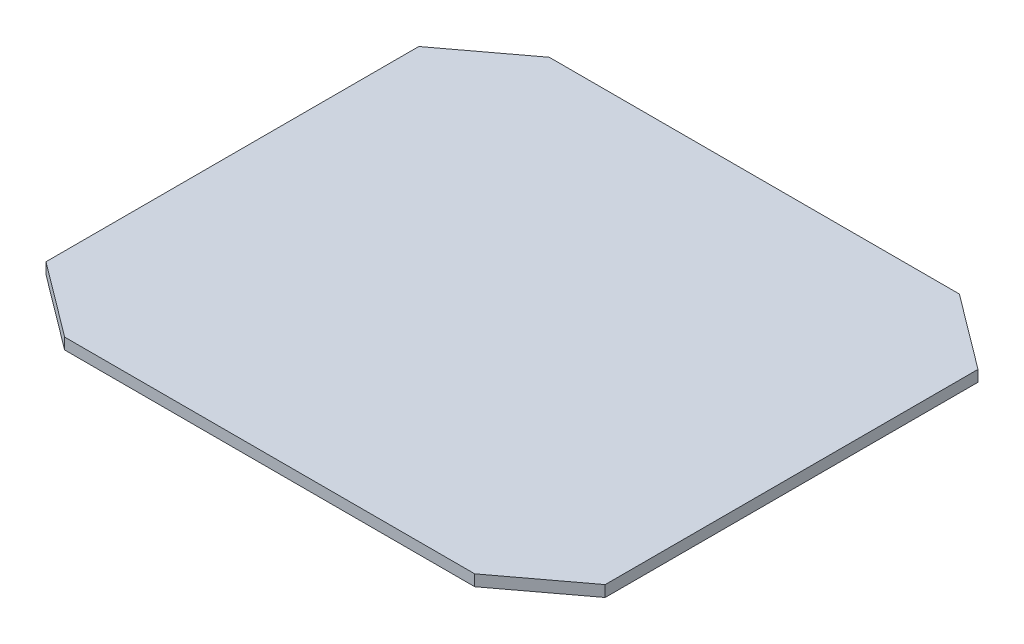
from build123d import *

# Parameters (mm, degrees)
SKETCH1_W           = 150
SKETCH1_H           = 130
BOSS_EXTRUDE1_DEPTH = 3
CUT_EXTRUDE1_DEPTH  = 100.292497199


with BuildPart() as part:
    # Sketch1 → Boss-Extrude1 (new body)
    with BuildSketch(Plane(origin=(0, 0, 0), x_dir=(1, 0, 0), z_dir=(0, 1, 0))):
        Rectangle(SKETCH1_W, SKETCH1_H)
    extrude(amount=BOSS_EXTRUDE1_DEPTH)

    # Sketch2 → Cut-Extrude1 (cut, through all)
    with BuildSketch(Plane(origin=(0, 3, 0), x_dir=(1, 0, 0), z_dir=(0, 1, 0))):
        Polygon((-55, 65), (-75, 50), (-75, 65), align=None)
        Polygon((-75, -50), (-55, -65), (-75, -65), align=None)
        Polygon((75, -50), (55, -65), (75, -65), align=None)
        Polygon((55, 65), (75, 50), (75, 65), align=None)
    extrude(amount=-CUT_EXTRUDE1_DEPTH, mode=Mode.SUBTRACT)


solid = part.part
